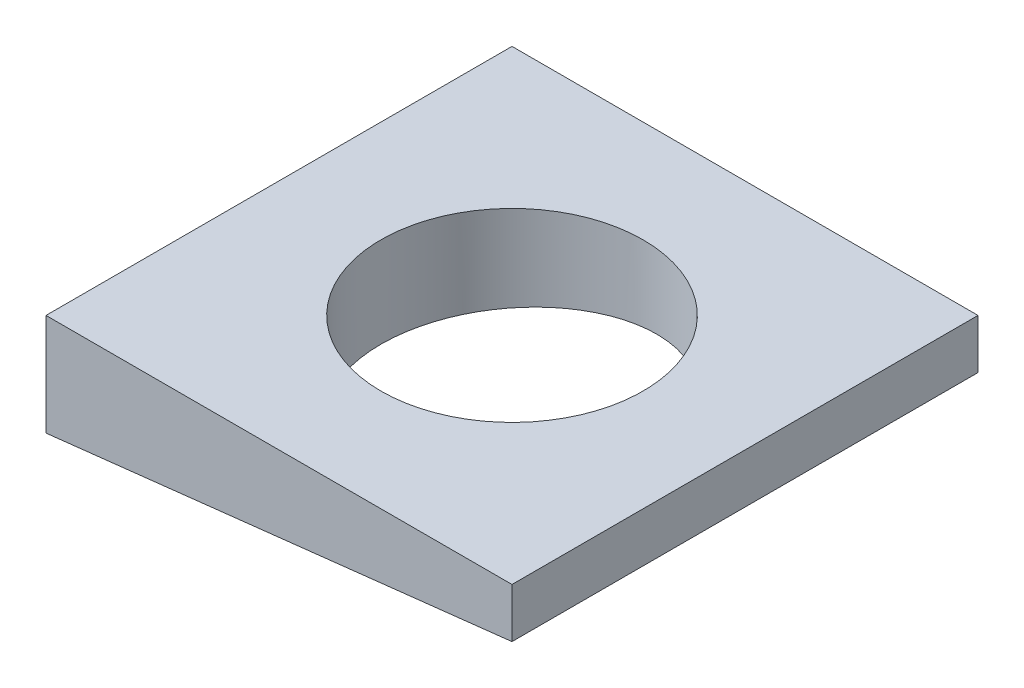
from build123d import *

# Parameters (mm, degrees)
VYSUNOUT1_DEPTH          = 16
SKICA2_R                 = 4.5
ODEBRAT_VYSUNUT_M1_DEPTH = 23.896506284


with BuildPart() as part:
    # Skica1 → Vysunout1 (new body)
    with BuildSketch(Plane.XY):
        Polygon((0, 0), (16, 0), (16, -1.7), (0, -3.5), align=None)
    extrude(amount=VYSUNOUT1_DEPTH)

    # Skica2 → Odebrat vysunutím1 (cut, through all)
    with BuildSketch(Plane(origin=(0, 0, 0), x_dir=(-1, 0, 0), z_dir=(0, 1, 0))):
        with Locations(Location((-8, 8, 0), (0, 0, 90))):
            Circle(SKICA2_R)
    extrude(amount=-ODEBRAT_VYSUNUT_M1_DEPTH, mode=Mode.SUBTRACT)


solid = part.part
